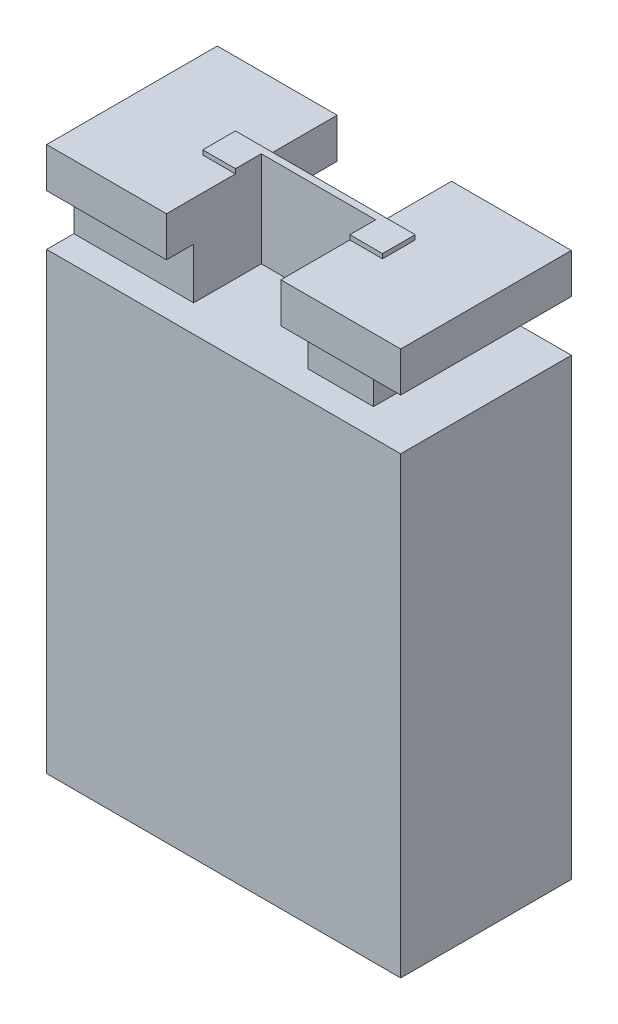
from build123d import *

# Parameters (mm, degrees)
SKETCH2_W           = 4.953
SKETCH2_H           = 2.3876
BOSS_EXTRUDE1_DEPTH = 7.62
SKETCH3_W           = 0.381
SKETCH3_H           = 0.7112
CUT_EXTRUDE1_DEPTH  = 10.166338824
CUT_EXTRUDE2_REACH  = 10.26
SKETCH4_W           = 0.762
SKETCH4_H           = 0.7112
CUT_EXTRUDE3_START  = -1.27
SKETCH5_W           = 1.6002
SKETCH5_H           = 1.32608066
SKETCH5_H_2         = 0.9652
CUT_EXTRUDE3_DEPTH  = 1.27
BOSS_EXTRUDE2_DEPTH = 0.0635


with BuildPart() as part:
    # Sketch2 → Boss-Extrude1 (new body)
    with BuildSketch(Plane(origin=(0, 0, 0), x_dir=(1, 0, 0), z_dir=(0, 1, 0))):
        Rectangle(SKETCH2_W, SKETCH2_H)
    extrude(amount=BOSS_EXTRUDE1_DEPTH)

    # Sketch3 → Cut-Extrude1 (cut, through all)
    with BuildSketch(Plane(origin=(2.4765, 0, 0), x_dir=(0, 0, -1), z_dir=(1, 0, 0))):
        with Locations((-1.0033, 6.7056)):
            Rectangle(SKETCH3_W, SKETCH3_H)
        with Locations((1.0033, 6.7056)):
            Rectangle(SKETCH3_W, SKETCH3_H)
    extrude(amount=-CUT_EXTRUDE1_DEPTH, mode=Mode.SUBTRACT)

    # Sketch4 → Cut-Extrude2 (cut, up to next)
    with BuildSketch(Plane.XY.offset(0.8128), mode=Mode.PRIVATE) as cut_extrude2_sk1:
        with Locations((2.0955, 6.7056)):
            Rectangle(SKETCH4_W, SKETCH4_H)
    cut_extrude2_tool1 = extrude(cut_extrude2_sk1.sketch, amount=-CUT_EXTRUDE2_REACH, mode=Mode.PRIVATE) & part.part
    add(cut_extrude2_tool1.solids().sort_by_distance((2.0955, 6.7056, 0.8128))[0], mode=Mode.SUBTRACT)

    # Sketch5 → Cut-Extrude3 (cut)
    with BuildSketch(Plane(origin=(0, 7.62, 0), x_dir=(1, 0, 0), z_dir=(0, 1, 0)).offset(CUT_EXTRUDE3_START)):
        with Locations((0, -0.53075967)):
            Rectangle(SKETCH5_W, SKETCH5_H)
        with Locations((0, 0.7112)):
            Rectangle(SKETCH5_W, SKETCH5_H_2)
    extrude(amount=CUT_EXTRUDE3_DEPTH, mode=Mode.SUBTRACT)

    # Sketch6 → Boss-Extrude2 (add)
    with BuildSketch(Plane(origin=(0, 7.62, 0), x_dir=(1, 0, 0), z_dir=(0, 1, 0))):
        Polygon((-0.8001, 0.13228066), (0.8001, 0.13228066), (0.8001, -0.2286), (1.2573, -0.2286), (1.2573, 0.2286), (0.8001, 0.2286), (-0.8001, 0.2286), (-1.2573, 0.2286), (-1.2573, -0.2286), (-0.8001, -0.2286), align=None)
    extrude(amount=BOSS_EXTRUDE2_DEPTH)


solid = part.part
